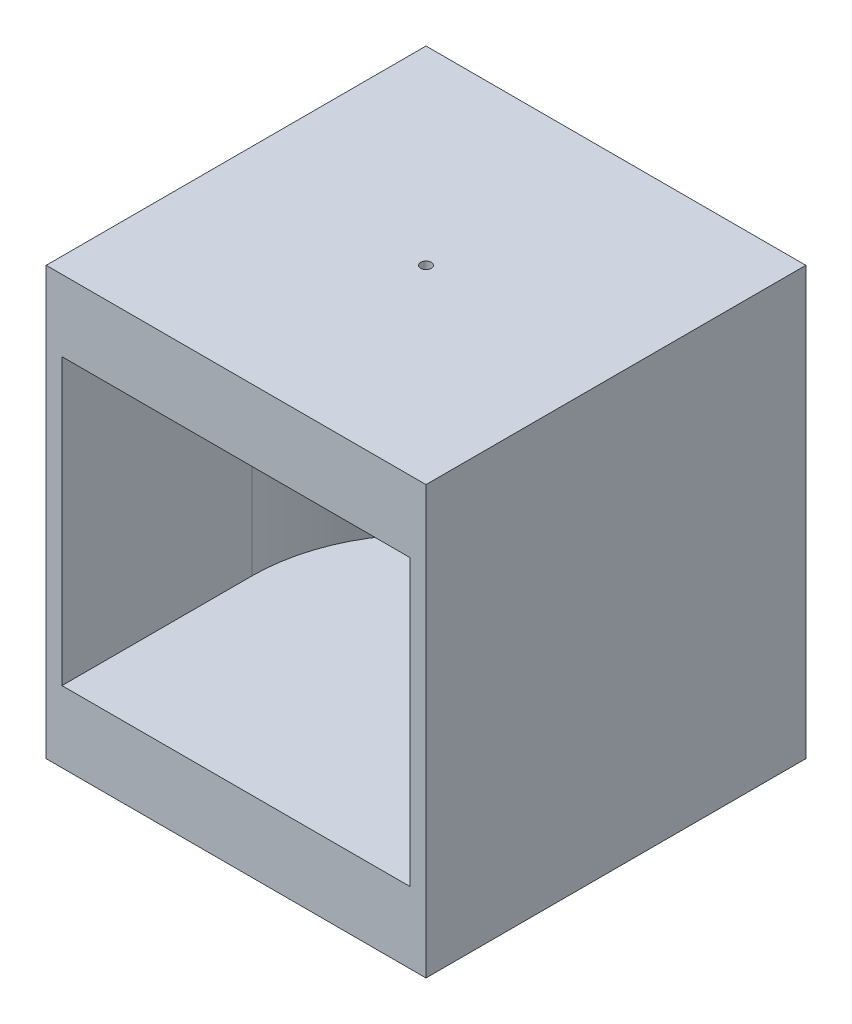
from build123d import *

# Parameters (mm, degrees)
SKETCH_2_W               = 720
SKETCH_2_H               = 720
EXTRUDE_2_DEPTH          = 405
CUT_EXTRUDE_1_DEPTH      = 270
CUT_EXTRUDE_2_DEPTH      = 651.557453266
CUT_EXTRUDE_2_DEPTH_BACK = 651.557453266
SKETCH_3_R               = 10


with BuildPart() as part:
    # 草图2 → 凸台-拉伸2 (new, symmetric)
    with BuildSketch(Plane(origin=(0, 0, 0), x_dir=(1, 0, 0), z_dir=(0, 1, 0))):
        Rectangle(SKETCH_2_W, SKETCH_2_H)
    extrude(amount=EXTRUDE_2_DEPTH, both=True)

    # 草图1 → 切除-拉伸1 (cut, symmetric)
    with BuildSketch(Plane(origin=(0, 0, 0), x_dir=(1, 0, 0), z_dir=(0, 1, 0))):
        with BuildLine():
            Line((330, 0), (330, -360))
            Line((330, -360), (-330, -360))
            Line((-330, -360), (-330, 0))
            ThreePointArc((-330, 0), (0, 330), (330, 0))
        make_face()
    extrude(amount=CUT_EXTRUDE_1_DEPTH, both=True, mode=Mode.SUBTRACT)

    # 草图3 → 切除-拉伸2 (cut, two sides: drawn at the far end of the back side and taken through both)
    with BuildSketch(Plane(origin=(0, 0, 0), x_dir=(1, 0, 0), z_dir=(0, 1, 0)).offset(-CUT_EXTRUDE_2_DEPTH_BACK)):
        with Locations(Location((0, 0, 0), (0, 0, 270))):
            Circle(SKETCH_3_R)
    extrude(amount=CUT_EXTRUDE_2_DEPTH + CUT_EXTRUDE_2_DEPTH_BACK, mode=Mode.SUBTRACT)


solid = part.part
